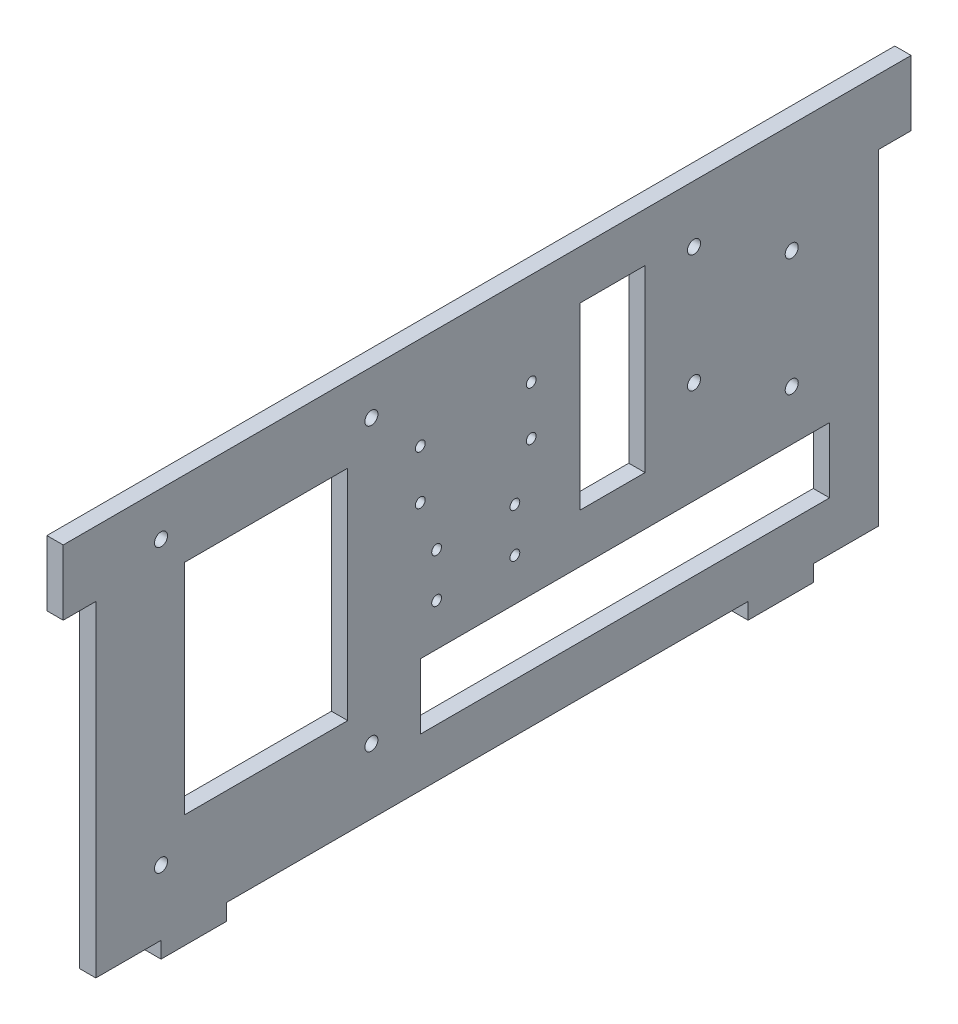
from build123d import *

# Parameters (mm, degrees)
SKIZZE2_W                       = 240
SKIZZE2_H                       = 120
SKIZZE2_W_2                     = 10
SKIZZE2_H_2                     = 20
SKIZZE2_W_3                     = 20
SKIZZE2_H_3                     = 5
AUFSATZ_LINEAR_AUSTRAGEN1_DEPTH = 5
SKIZZE3_R                       = 2
SKIZZE3_R_2                     = 1.5
SCHNITT_LINEAR_AUSTRAGEN1_DEPTH = 146.430395722
SKIZZE4_R                       = 2
SCHNITT_LINEAR_AUSTRAGEN2_DEPTH = 146.430395722
SKIZZE6_W                       = 50
SKIZZE6_H                       = 67.054263566
SKIZZE6_W_2                     = 125.5
SKIZZE6_H_2                     = 20
SKIZZE6_W_3                     = 19.924
SKIZZE6_H_3                     = 55
SCHNITT_LINEAR_AUSTRAGEN3_DEPTH = 146.430395722


with BuildPart() as part:
    # Skizze2 → Aufsatz-Linear austragen1 (new body)
    with BuildSketch(Plane(origin=(0, 0, 0), x_dir=(0, 0, -1), z_dir=(1, 0, 0))):
        Rectangle(SKIZZE2_W, SKIZZE2_H)
        with Locations((-125, 50)):
            Rectangle(SKIZZE2_W_2, SKIZZE2_H_2)
        with Locations((125, 50)):
            Rectangle(SKIZZE2_W_2, SKIZZE2_H_2)
        with Locations((-90, -62.5)):
            Rectangle(SKIZZE2_W_3, SKIZZE2_H_3)
        with Locations((90, -62.5)):
            Rectangle(SKIZZE2_W_3, SKIZZE2_H_3)
    extrude(amount=AUFSATZ_LINEAR_AUSTRAGEN1_DEPTH)

    # Skizze3 → Schnitt-Linear austragen1 (cut, through all)
    with BuildSketch(Plane.ZY):
        with Locations((35.5, 46.5)):
            Circle(SKIZZE3_R)
        with Locations((100, 46.5)):
            Circle(SKIZZE3_R)
        with Locations((100, -40)):
            Circle(SKIZZE3_R)
        with Locations((35.5, -40)):
            Circle(SKIZZE3_R)
        with Locations((20.5, 31.5)):
            Circle(SKIZZE3_R_2)
        with Locations((-13.5, 31.5)):
            Circle(SKIZZE3_R_2)
        with Locations((-13.5, 16.5)):
            Circle(SKIZZE3_R_2)
        with Locations((20.5, 16.5)):
            Circle(SKIZZE3_R_2)
        with Locations((15.5, 1.5)):
            Circle(SKIZZE3_R_2)
        with Locations((15.5, -12)):
            Circle(SKIZZE3_R_2)
        with Locations((-8.5, 1.5)):
            Circle(SKIZZE3_R_2)
        with Locations((-8.5, -12)):
            Circle(SKIZZE3_R_2)
    extrude(amount=-SCHNITT_LINEAR_AUSTRAGEN1_DEPTH, mode=Mode.SUBTRACT)

    # Skizze4 → Schnitt-Linear austragen2 (cut, through all)
    with BuildSketch(Plane(origin=(5, 0, 0), x_dir=(0, 0, -1), z_dir=(1, 0, 0))):
        with Locations((63.424, 42.46)):
            Circle(SKIZZE4_R)
        with Locations((93.396, 26.46)):
            Circle(SKIZZE4_R)
        with Locations((63.424, 6.38)):
            Circle(SKIZZE4_R)
        with Locations((93.396, -9.62)):
            Circle(SKIZZE4_R)
    extrude(amount=-SCHNITT_LINEAR_AUSTRAGEN2_DEPTH, mode=Mode.SUBTRACT)

    # Skizze6 → Schnitt-Linear austragen3 (cut, through all)
    with BuildSketch(Plane(origin=(5, 0, 0), x_dir=(0, 0, -1), z_dir=(1, 0, 0))):
        with Locations((-67.75, 3.25)):
            Rectangle(SKIZZE6_W, SKIZZE6_H)
        with Locations((42.25, -35)):
            Rectangle(SKIZZE6_W_2, SKIZZE6_H_2)
        with Locations((38.462, 17.5)):
            Rectangle(SKIZZE6_W_3, SKIZZE6_H_3)
    extrude(amount=-SCHNITT_LINEAR_AUSTRAGEN3_DEPTH, mode=Mode.SUBTRACT)


solid = part.part
